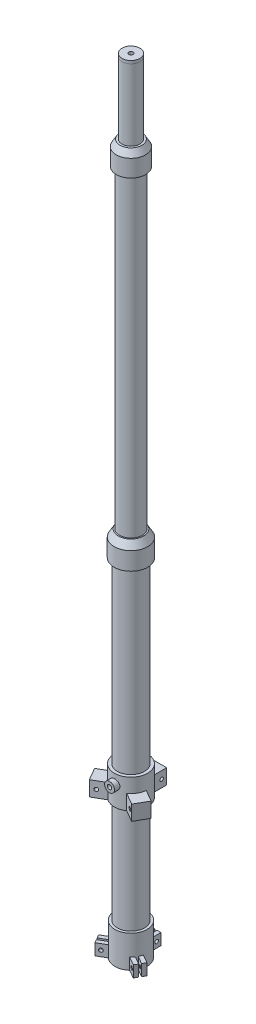
from build123d import *

# Parameters (mm, degrees)
SKETCH_1_R               = 20.5
EXTRUDE_1_DEPTH          = 33
CHAMFER_1_SIZE           = 9
CHAMFER_1_SIZE2          = 5.196152423
SKETCH_2_R               = 16
F_2_MAX_440_DEPTH        = 440
SKETCH_3_R               = 23.5
EXTRUDE_3_DEPTH          = 35
CHAMFER_2_SIZE           = 10
CHAMFER_2_SIZE2          = 5.773502692
SKETCH_4_R               = 19
EXTRUDE_4_DEPTH          = 485
SKETCH_12_R              = 18
CUT_EXTRUDE_2_DEPTH      = 510
SKETCH_14_R              = 15.5
CUT_EXTRUDE_3_DEPTH      = 481
SKETCH_15_R              = 12.5
SKETCH_15_R_2            = 11.5
F_1_MAX_500_DEPTH        = 100
CUT_EXTRUDE_START        = -5
SKETCH_16_R              = 11.5
CUT_EXTRUDE_4_DEPTH      = 5
SKETCH_17_R              = 12.5
EXTRUDE_9_DEPTH          = 4
SKETCH_18_R              = 3
CUT_EXTRUDE_5_DEPTH      = 4
SKETCH_5_R               = 23.3
SKETCH_5_R_2             = 18.5
EXTRUDE_5_DEPTH          = 41
SKETCH_6_R               = 22.5
EXTRUDE_6_DEPTH          = 45
SKETCH_8_R               = 6.9
EXTRUDE_7_DEPTH          = 30
SKETCH_9_W               = 20
SKETCH_9_H               = 20.88996333
EXTRUDE_8_DEPTH          = 21
SKETCH_22_W              = 5.5
SKETCH_22_H              = 13.65349464
EXTRUDE_10_DEPTH         = 16
SKETCH_19_R              = 2.5
CUT_EXTRUDE_6_DEPTH      = 30
PATTERN_CIRCULAR_3_COUNT = 3
SKETCH_21_R              = 3
CUT_EXTRUDE_7_DEPTH      = 10


with BuildPart() as part:
    # Эскиз1 → Бобышка-Вытянуть1 (new body)
    with BuildSketch(Plane(origin=(0, 0, 0), x_dir=(1, 0, 0), z_dir=(0, 1, 0))):
        with Locations(Location((0, 0, 0), (0, 0, 270))):
            Circle(SKETCH_1_R)
    extrude(amount=EXTRUDE_1_DEPTH)

    # Фаска1
    chamfer_1_edges = [part.edges().sort_by_distance(p)[0] for p in [
        (0, 33, -20.5),
    ]]
    chamfer_1_side = [part.faces().sort_by_distance(p)[0] for p in [
        (0, 16.5, -20.5),
    ]]
    chamfer(chamfer_1_edges, length=CHAMFER_1_SIZE, length2=CHAMFER_1_SIZE2, reference=chamfer_1_side[0])

    # Эскиз2 → --столбик2 (max 440) (add)
    with BuildSketch(Plane.XZ):
        with Locations(Location((0, 0, 0), (0, 0, 270))):
            Circle(SKETCH_2_R)
    extrude(amount=F_2_MAX_440_DEPTH)

    # Эскиз3 → Бобышка-Вытянуть3 (add)
    with BuildSketch(Plane.XZ.offset(440)):
        with Locations(Location((0, 0, 0), (0, 0, 270))):
            Circle(SKETCH_3_R)
    extrude(amount=EXTRUDE_3_DEPTH)

    # Фаска2
    chamfer_2_edges = [part.edges().sort_by_distance(p)[0] for p in [
        (0, -440, 23.5),
    ]]
    chamfer_2_side = [part.faces().sort_by_distance(p)[0] for p in [
        (0, -457.5, 23.5),
    ]]
    chamfer(chamfer_2_edges, length=CHAMFER_2_SIZE, length2=CHAMFER_2_SIZE2, reference=chamfer_2_side[0])

    # Эскиз4 → Бобышка-Вытянуть4 (add)
    with BuildSketch(Plane.XZ.offset(475)):
        with Locations(Location((0, 0, 0), (0, 0, 270))):
            Circle(SKETCH_4_R)
    extrude(amount=EXTRUDE_4_DEPTH)

    # Эскиз12 → Вырез-Вытянуть2 (cut)
    with BuildSketch(Plane.XZ.offset(960)):
        with Locations(Location((0, 0, 0), (0, 0, 270))):
            Circle(SKETCH_12_R)
    extrude(amount=-CUT_EXTRUDE_2_DEPTH, mode=Mode.SUBTRACT)

    # Эскиз14 → Вырез-Вытянуть3 (cut)
    with BuildSketch(Plane.XZ.offset(450)):
        with Locations(Location((0, 0, 0), (0, 0, 270))):
            Circle(SKETCH_14_R)
    extrude(amount=-CUT_EXTRUDE_3_DEPTH, mode=Mode.SUBTRACT)

    # Эскиз15 → --столбик1 (max 500) (add)
    with BuildSketch(Plane(origin=(0, 33, 0), x_dir=(1, 0, 0), z_dir=(0, 1, 0))):
        Circle(SKETCH_15_R)
        Circle(SKETCH_15_R_2, mode=Mode.SUBTRACT)
    extrude(amount=F_1_MAX_500_DEPTH)

    # Эскиз16 → Вырез-Вытянуть4 (cut)
    with BuildSketch(Plane(origin=(0, 33, 0), x_dir=(1, 0, 0), z_dir=(0, 1, 0)).offset(CUT_EXTRUDE_START)):
        Circle(SKETCH_16_R)
    extrude(amount=CUT_EXTRUDE_4_DEPTH, mode=Mode.SUBTRACT)

    # Эскиз5 → Бобышка-Вытянуть5 (add)
    with BuildSketch(Plane(origin=(0, -725, 0), x_dir=(-1, 0, 0), z_dir=(0, -1, 0))):
        with Locations(Location((0, 0, 0), (0, 0, 90))):
            Circle(SKETCH_5_R)
        Circle(SKETCH_5_R_2, mode=Mode.SUBTRACT)
    extrude(amount=EXTRUDE_5_DEPTH)

    # Эскиз6 → Бобышка-Вытянуть6 (add)
    with BuildSketch(Plane.XZ.offset(960)):
        with Locations(Location((0, 0, 0), (0, 0, 270))):
            Circle(SKETCH_6_R)
    extrude(amount=-EXTRUDE_6_DEPTH)

    # Эскиз8 → Бобышка-Вытянуть7 (add)
    with BuildSketch(Plane.XY):
        with Locations(Location((0, -738.5, 0), (0, 0, 270))):
            Circle(SKETCH_8_R)
    extrude(amount=EXTRUDE_7_DEPTH)

    # Эскиз9 → Бобышка-Вытянуть8 (add)
    with BuildSketch(Plane.XZ.offset(766)):
        Polygon((-39.641016151, 11.339745962), (-29.641016151, 28.660254038), (-11.549777223, 18.215272373), (-21.549777223, 0.894764297), align=None)
        with Locations((0, -29.555018335)):
            Rectangle(SKETCH_9_W, SKETCH_9_H)
        Polygon((29.641016151, 28.660254038), (39.641016151, 11.339745962), (21.549777223, 0.894764297), (11.549777223, 18.215272373), align=None)
    extrude(amount=-EXTRUDE_8_DEPTH)

    # Эскиз22 → Бобышка-Вытянуть10 (add)
    with BuildSketch(Plane.XZ.offset(960)):
        with Locations((4.25, -28.2101521)):
            Rectangle(SKETCH_22_W, SKETCH_22_H)
        with Locations((-4.25, -28.2101521)):
            Rectangle(SKETCH_22_W, SKETCH_22_H)
        Polygon((-33.842844968, 11.456271884), (-22.018571759, 4.629524564), (-19.268571759, 9.392664284), (-31.092844968, 16.219411605), align=None)
        Polygon((-26.842844968, 23.580627537), (-15.018571759, 16.753880217), (-17.768571759, 11.990740496), (-29.592844968, 18.817487816), align=None)
        Polygon((26.842844968, 23.580627537), (15.018571759, 16.753880217), (17.768571759, 11.990740496), (29.592844968, 18.817487816), align=None)
        Polygon((33.842844968, 11.456271884), (22.018571759, 4.629524564), (19.268571759, 9.392664284), (31.092844968, 16.219411605), align=None)
    extrude(amount=-EXTRUDE_10_DEPTH)

    # Эскиз19 → Вырез-Вытянуть6 (cut)
    with BuildSketch(Plane(origin=(5, 0, 8.660254038), x_dir=(0.8660254037844387, 0, -0.4999999999999999), z_dir=(0.49999999999999994, 0, 0.8660254037844388))):
        with Locations((-33, -755.5)):
            Circle(SKETCH_19_R)
        with Locations((-29.03689942, -952)):
            Circle(SKETCH_19_R)
    cut_extrude_6 = extrude(amount=-CUT_EXTRUDE_6_DEPTH, mode=Mode.SUBTRACT)

    # Круговой массив3: Вырез-Вытянуть6 ×3 about axis
    pattern_circular_3_axis = Axis((0, -960, 0), (0, 1, 0))
    for i in range(1, PATTERN_CIRCULAR_3_COUNT):
        add(cut_extrude_6.rotate(pattern_circular_3_axis, i * 360 / PATTERN_CIRCULAR_3_COUNT), mode=Mode.SUBTRACT)

    # Эскиз21 → Вырез-Вытянуть7 (cut)
    with BuildSketch(Plane.XY.offset(30)):
        with Locations((0, -738.5)):
            Circle(SKETCH_21_R)
    extrude(amount=-CUT_EXTRUDE_7_DEPTH, mode=Mode.SUBTRACT)


with BuildPart() as body_2:
    # Эскиз17 → Бобышка-Вытянуть9 (new body)
    with BuildSketch(Plane(origin=(0, 133, 0), x_dir=(1, 0, 0), z_dir=(0, 1, 0))):
        with Locations(Location((0, 0, 0), (0, 0, 270))):
            Circle(SKETCH_17_R)
    extrude(amount=EXTRUDE_9_DEPTH)

    # Эскиз18 → Вырез-Вытянуть5 (cut)
    with BuildSketch(Plane(origin=(0, 137, 0), x_dir=(1, 0, 0), z_dir=(0, 1, 0))):
        with Locations(Location((0, 0, 0), (0, 0, 270))):
            Circle(SKETCH_18_R)
    extrude(amount=-CUT_EXTRUDE_5_DEPTH, mode=Mode.SUBTRACT)


solid = Compound([part.part, body_2.part])
